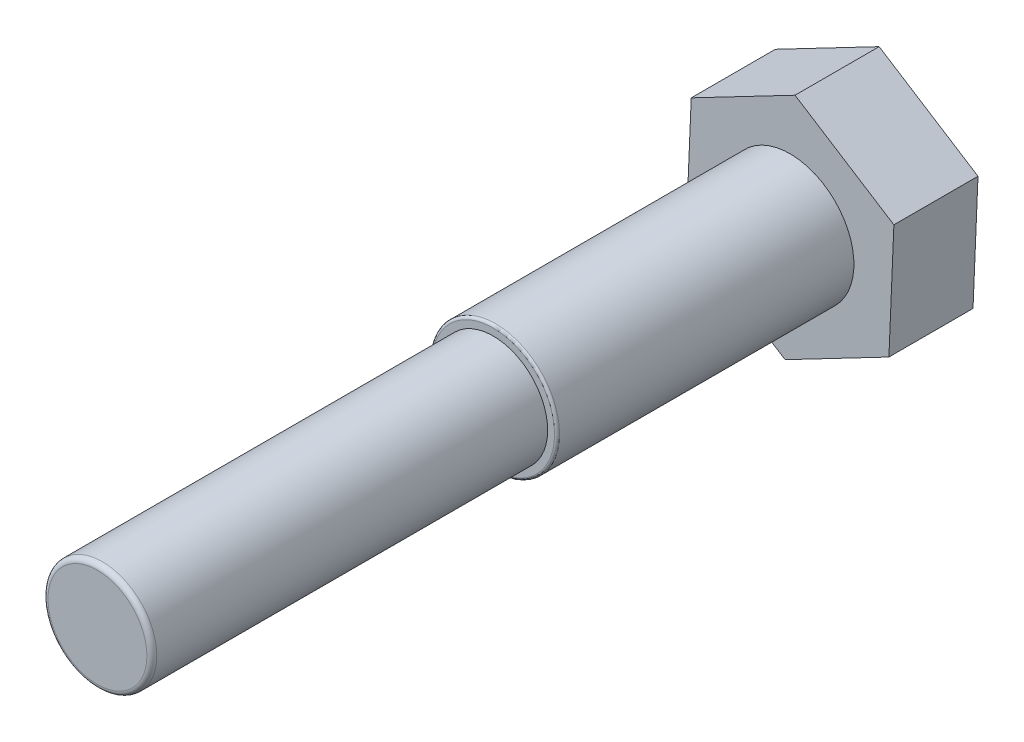
from build123d import *

# Parameters (mm, degrees)
EXTRUDE_379_DEPTH = 17
SKETCH_2_R        = 12.9
EXTRUDE_1_DEPTH   = 60
SKETCH_3_R        = 11
EXTRUDE_2_DEPTH   = 80
FILLET_2_R        = 1
FILLET_4_R        = 0.5


with BuildPart() as part:
    # 草图1 → Extrude 379 (new body)
    with BuildSketch(Plane.XY):
        Polygon((20.984201837, 10.954296262), (1.005402075, 23.65), (-19.978799762, 12.695703738), (-20.984201837, -10.954296262), (-1.005402075, -23.65), (19.978799762, -12.695703738), align=None)
    extrude(amount=EXTRUDE_379_DEPTH)

    # 草图2 → 凸台-拉伸1 (add)
    with BuildSketch(Plane.XY.offset(17)):
        with Locations(Location((0, 0, 0), (0, 0, 180))):
            Circle(SKETCH_2_R)
    extrude(amount=EXTRUDE_1_DEPTH)

    # 草图3 → 凸台-拉伸2 (add)
    with BuildSketch(Plane.XY.offset(77)):
        Circle(SKETCH_3_R)
    extrude(amount=EXTRUDE_2_DEPTH)

    # 圆角2
    fillet_2_edges = [part.edges().sort_by_distance(p)[0] for p in [
        (-11, 0, 157),
    ]]
    fillet(fillet_2_edges, radius=FILLET_2_R)

    # 圆角4
    fillet_4_edges = [part.edges().sort_by_distance(p)[0] for p in [
        (12.9, 0, 77),
    ]]
    fillet(fillet_4_edges, radius=FILLET_4_R)


solid = part.part
